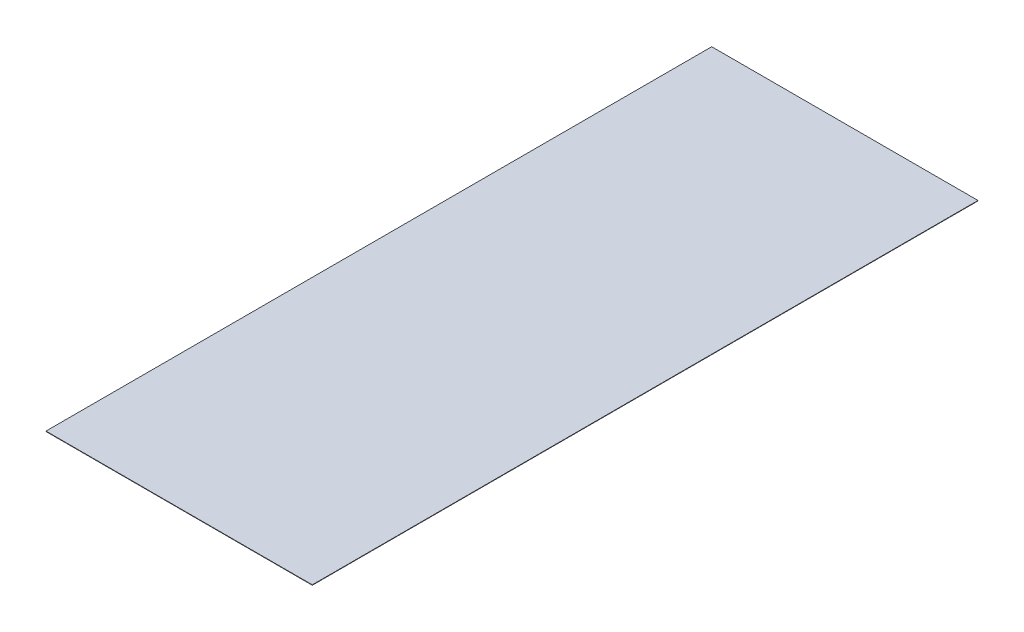
from build123d import *

# Parameters (mm, degrees)
CROQUIS1_W              = 1219.2
CROQUIS1_H              = 3048
SALIENTE_EXTRUIR1_DEPTH = 1.9


with BuildPart() as part:
    # Croquis1 → Saliente-Extruir1 (new body)
    with BuildSketch(Plane(origin=(0, 0, 0), x_dir=(1, 0, 0), z_dir=(0, 1, 0))):
        Rectangle(CROQUIS1_W, CROQUIS1_H)
    extrude(amount=SALIENTE_EXTRUIR1_DEPTH)


solid = part.part
